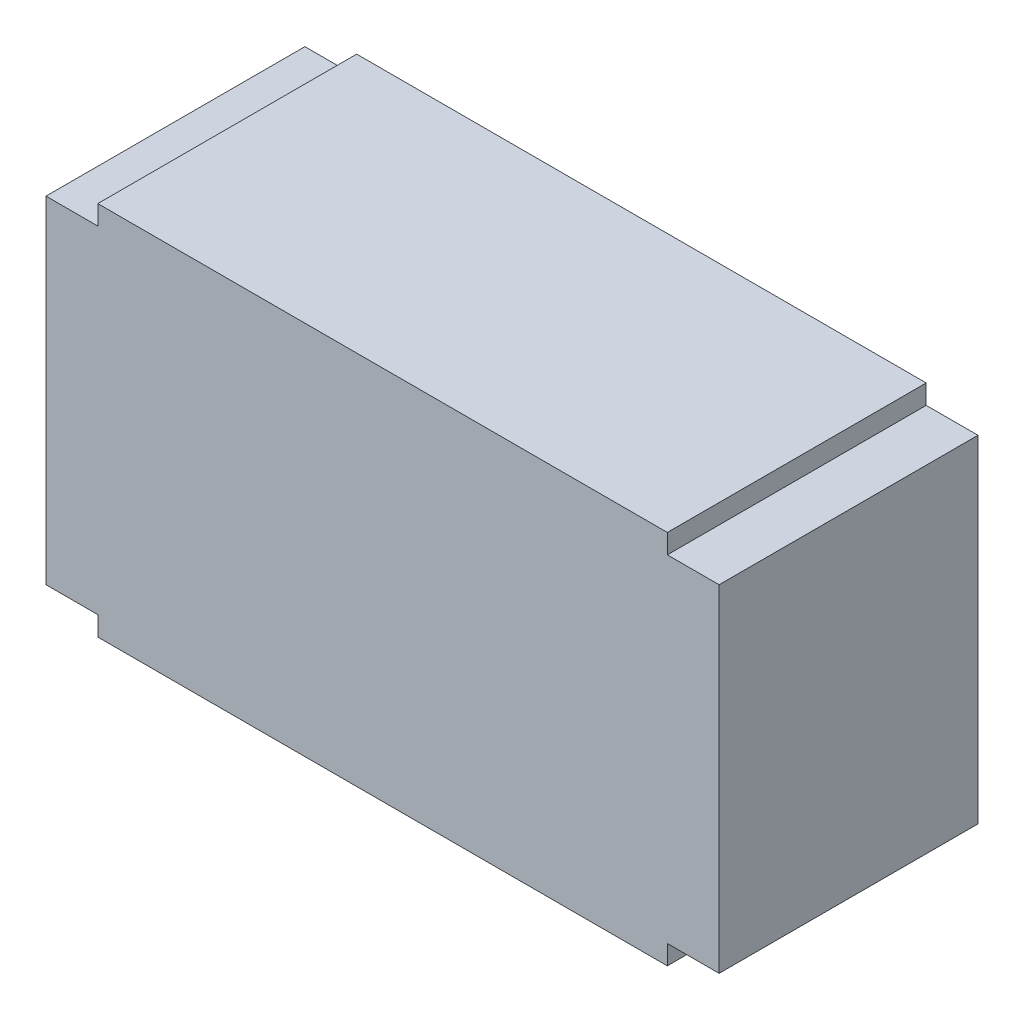
from build123d import *

# Parameters (mm, degrees)
COMPONENT_OUTLINE_DEPTH = 1


with BuildPart() as part:
    # 草图1 → Component_Outline (new body)
    with BuildSketch(Plane.XY):
        Polygon((-1.3, 0.65), (-1.1, 0.65), (-1.1, 0.725), (1.1, 0.725), (1.1, 0.65), (1.3, 0.65), (1.3, -0.65), (1.1, -0.65), (1.1, -0.725), (-1.1, -0.725), (-1.1, -0.65), (-1.3, -0.65), align=None)
    extrude(amount=COMPONENT_OUTLINE_DEPTH)


solid = part.part
